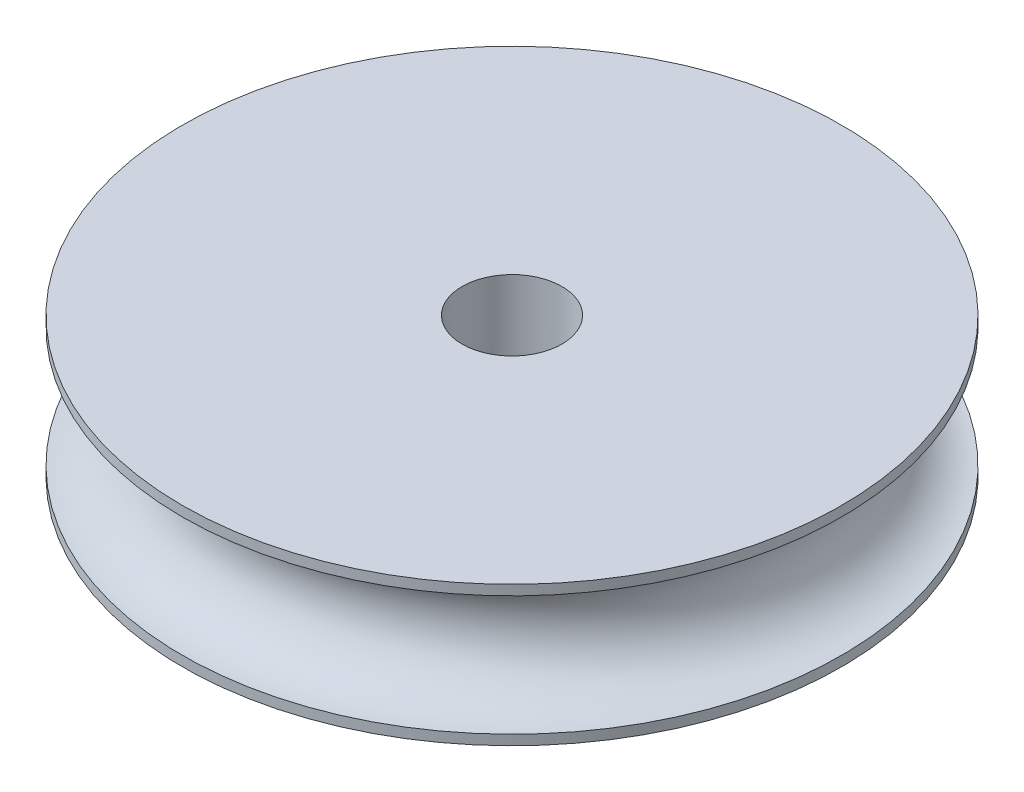
from build123d import *

# Parameters (mm, degrees)
SKETCH2_R           = 16.5
BOSS_EXTRUDE1_DEPTH = 0.5
BOSS_EXTRUDE2_START = 0.5
SKETCH3_R           = 16.5
BOSS_EXTRUDE2_DEPTH = 0.5
SKETCH4_R           = 1
CUT_EXTRUDE1_DEPTH  = 7
SKETCH5_R           = 2.5
CUT_EXTRUDE2_DEPTH  = 10


with BuildPart() as part:
    # Sketch1 → Revolve1 (revolve)
    with BuildSketch(Plane.XY, mode=Mode.PRIVATE) as revolve1_sk:
        Polygon((0, 6), (0, 0), (13.5, 0), (13.5, 3), (13.5, 6), align=None)
        with BuildLine():
            Line((13.5, 6), (13.5, 3))
            ThreePointArc((13.5, 3), (14.378679656, 5.121320344), (16.5, 6))
            Line((16.5, 6), (13.5, 6))
        make_face()
        with BuildLine():
            Line((13.5, 3), (13.5, 0))
            Line((13.5, 0), (16.5, 0))
            ThreePointArc((16.5, 0), (14.378679656, 0.878679656), (13.5, 3))
        make_face()
    revolve(revolve1_sk.sketch.rotate(Axis((0, 0, 0), (0, 1, 0)), 90), axis=Axis((0, 0, 0), (0, 1, 0)))

    # Sketch2 → Boss-Extrude1 (add)
    with BuildSketch(Plane(origin=(0, 6, 0), x_dir=(1, 0, 0), z_dir=(0, 1, 0))):
        with Locations(Location((0, 0, 0), (0, 0, 270))):
            Circle(SKETCH2_R)
    extrude(amount=BOSS_EXTRUDE1_DEPTH)

    # Sketch3 → Boss-Extrude2 (add)
    with BuildSketch(Plane.XZ.offset(BOSS_EXTRUDE2_START)):
        with Locations(Location((0, 0, 0), (0, 0, 90))):
            Circle(SKETCH3_R)
    extrude(amount=-BOSS_EXTRUDE2_DEPTH)

    # Sketch4 → Cut-Extrude1 (cut)
    with BuildSketch(Plane.XZ.offset(0.5)):
        with Locations(Location((0, 0, 0), (0, 0, 270))):
            Circle(SKETCH4_R)
    extrude(amount=-CUT_EXTRUDE1_DEPTH, mode=Mode.SUBTRACT)

    # Sketch5 → Cut-Extrude2 (cut)
    with BuildSketch(Plane(origin=(0, 6.5, 0), x_dir=(1, 0, 0), z_dir=(0, 1, 0))):
        with Locations(Location((0, 0, 0), (0, 0, 270))):
            Circle(SKETCH5_R)
    extrude(amount=-CUT_EXTRUDE2_DEPTH, mode=Mode.SUBTRACT)


solid = part.part
